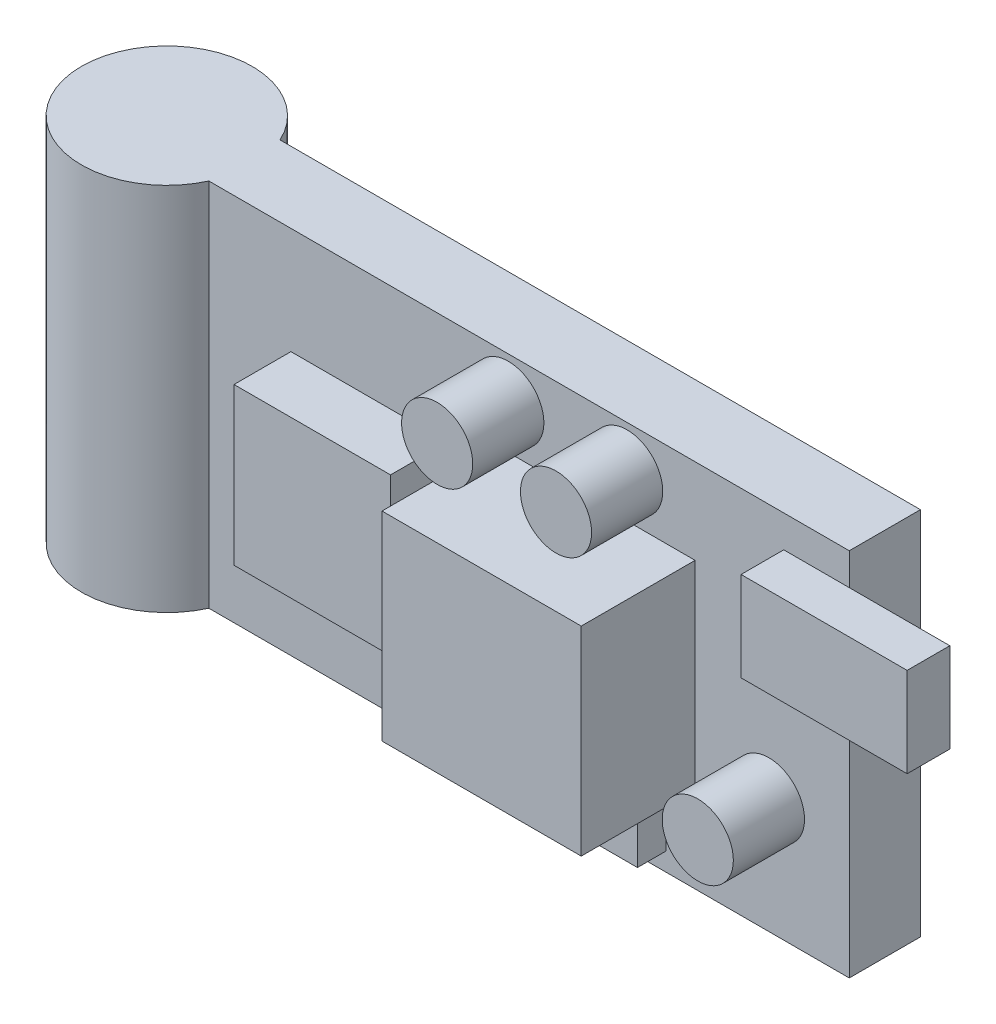
from build123d import *

# Parameters (mm, degrees)
SKETCH_1_W      = 45
SKETCH_1_H      = 26
EXTRUDE_1_DEPTH = 5
SKETCH_2_R      = 6
EXTRUDE_2_DEPTH = 26
SKETCH_3_W      = 14
SKETCH_3_H      = 14
EXTRUDE_3_DEPTH = 8
SKETCH_4_R      = 2.5
EXTRUDE_4_DEPTH = 5
SKETCH_5_W      = 11
SKETCH_5_H      = 11
EXTRUDE_5_DEPTH = 4
SKETCH_6_W      = 6.186657106
SKETCH_6_H      = 3.588261122
SKETCH_6_W_2    = 6.062923964
EXTRUDE_6_DEPTH = 2
SKETCH_7_W      = 11.669170616
SKETCH_7_H      = 6.291205027
EXTRUDE_7_DEPTH = 3


with BuildPart() as part:
    # Эскиз1 → Бобышка-Вытянуть1 (new body)
    with BuildSketch(Plane.XY):
        Rectangle(SKETCH_1_W, SKETCH_1_H)
    extrude(amount=EXTRUDE_1_DEPTH)

    # Эскиз2 → Бобышка-Вытянуть2 (add)
    with BuildSketch(Plane(origin=(0, 13, 0), x_dir=(1, 0, 0), z_dir=(0, 1, 0))):
        with Locations((-27.954356057, -2.5)):
            Circle(SKETCH_2_R)
    extrude(amount=-EXTRUDE_2_DEPTH)

    # Эскиз3 → Бобышка-Вытянуть3 (add)
    with BuildSketch(Plane.XY.offset(5)):
        with Locations((4.666405911, 0)):
            Rectangle(SKETCH_3_W, SKETCH_3_H)
    extrude(amount=EXTRUDE_3_DEPTH)

    # Эскиз4 → Бобышка-Вытянуть4 (add)
    with BuildSketch(Plane.XY.offset(5)):
        with Locations((-1.458384625, 10.053317798)):
            Circle(SKETCH_4_R)
        with Locations((6.893602469, 10.053317798)):
            Circle(SKETCH_4_R)
        with Locations((16.854120411, -4.9183924)):
            Circle(SKETCH_4_R)
    extrude(amount=EXTRUDE_4_DEPTH)

    # Эскиз5 → Бобышка-Вытянуть5 (add)
    with BuildSketch(Plane.XY.offset(5)):
        with Locations((-11.233302854, 0)):
            Rectangle(SKETCH_5_W, SKETCH_5_H)
    extrude(amount=EXTRUDE_5_DEPTH)

    # Эскиз6 → Бобышка-Вытянуть6 (add)
    with BuildSketch(Plane.XY.offset(5)):
        with Locations((-2.279728316, -9.926144411)):
            Rectangle(SKETCH_6_W, SKETCH_6_H)
        with Locations((6.585206892, -9.926144411)):
            Rectangle(SKETCH_6_W_2, SKETCH_6_H)
    extrude(amount=EXTRUDE_6_DEPTH)

    # Эскиз7 → Бобышка-Вытянуть7 (add)
    with BuildSketch(Plane.XY.offset(5)):
        with Locations((23.730450038, 7.608351051)):
            Rectangle(SKETCH_7_W, SKETCH_7_H)
    extrude(amount=EXTRUDE_7_DEPTH)


solid = part.part
